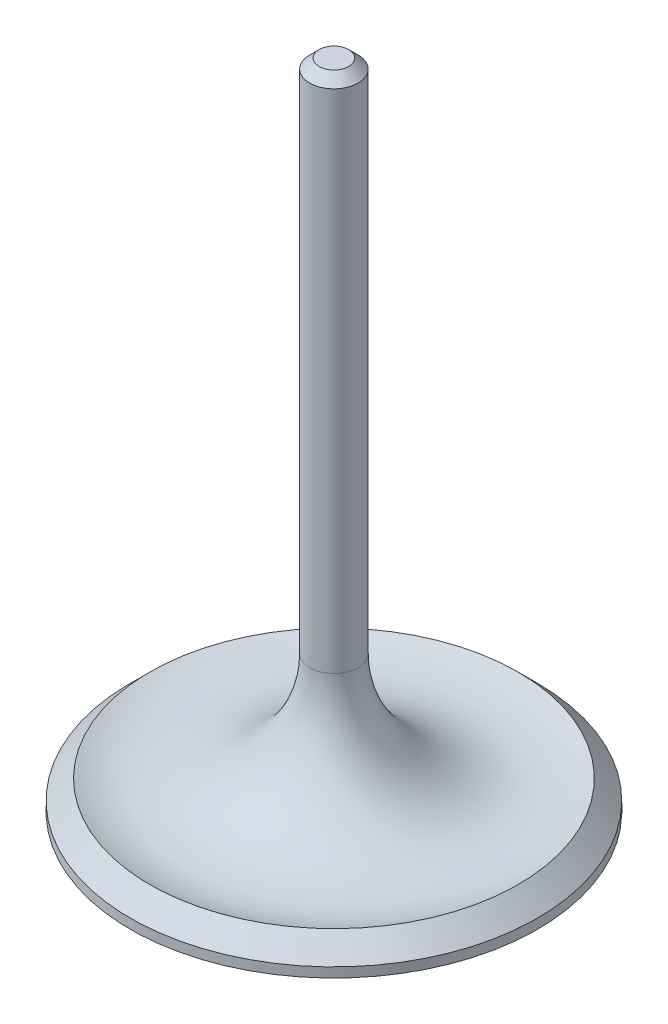
from build123d import *

# Parameters (mm, degrees)
CHAMFER1_SIZE = 1.25


with BuildPart() as part:
    # Sketch2 → Revolve1 (revolve)
    with BuildSketch(Plane(origin=(0, 0, 0), x_dir=(0, 0, -1), z_dir=(1, 0, 0))):
        with BuildLine():
            Line((0, 0), (0, 85.55))
            Line((0, 85.55), (3.18, 85.55))
            Line((3.18, 85.55), (3.18, 17.954698654))
            ThreePointArc((3.18, 17.954698654), (9.896609701, 5.315721242), (24.13, 3.81))
            Line((24.13, 3.81), (26.67, 1.27))
            Line((26.67, 1.27), (26.67, 0))
            Line((26.67, 0), (0, 0))
        make_face()
    revolve(axis=Axis((0, 0, 0), (0, 1, 0)))

    # Chamfer1
    chamfer1_edges = [part.edges().sort_by_distance(p)[0] for p in [
        (0, 85.55, 3.18),
    ]]
    chamfer(chamfer1_edges, length=CHAMFER1_SIZE)


solid = part.part
